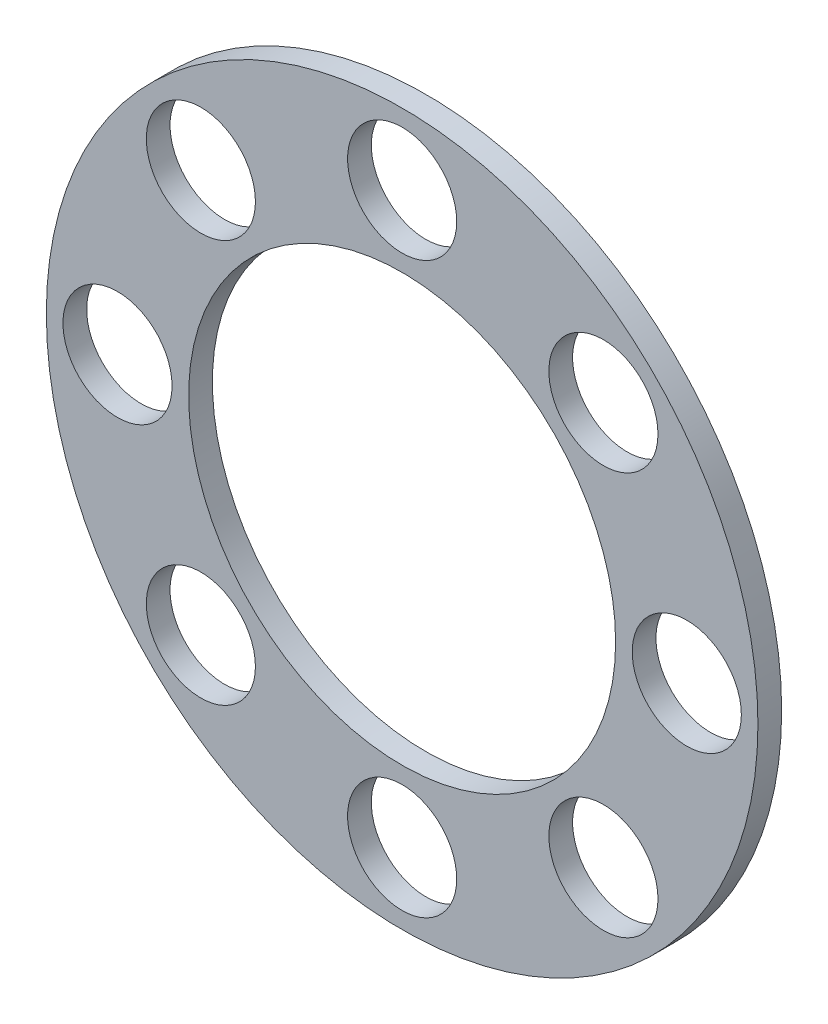
from build123d import *

# Parameters (mm, degrees)
SKETCH_1_R      = 7.5
SKETCH_1_R_2    = 1.15
SKETCH_1_R_3    = 4.5
EXTRUDE_1_DEPTH = 0.5


with BuildPart() as part:
    # 草图1 → 凸台-拉伸1 (new body)
    with BuildSketch(Plane.XY):
        Circle(SKETCH_1_R)
        with Locations((0, 6)):
            Circle(SKETCH_1_R_2, mode=Mode.SUBTRACT)
        Circle(SKETCH_1_R_3, mode=Mode.SUBTRACT)
        with Locations((4.242640687, 4.242640687)):
            Circle(SKETCH_1_R_2, mode=Mode.SUBTRACT)
        with Locations((6, 0)):
            Circle(SKETCH_1_R_2, mode=Mode.SUBTRACT)
        with Locations((4.242640687, -4.242640687)):
            Circle(SKETCH_1_R_2, mode=Mode.SUBTRACT)
        with Locations((0, -6)):
            Circle(SKETCH_1_R_2, mode=Mode.SUBTRACT)
        with Locations((-4.242640687, -4.242640687)):
            Circle(SKETCH_1_R_2, mode=Mode.SUBTRACT)
        with Locations((-6, 0)):
            Circle(SKETCH_1_R_2, mode=Mode.SUBTRACT)
        with Locations((-4.242640687, 4.242640687)):
            Circle(SKETCH_1_R_2, mode=Mode.SUBTRACT)
    extrude(amount=EXTRUDE_1_DEPTH)


solid = part.part
